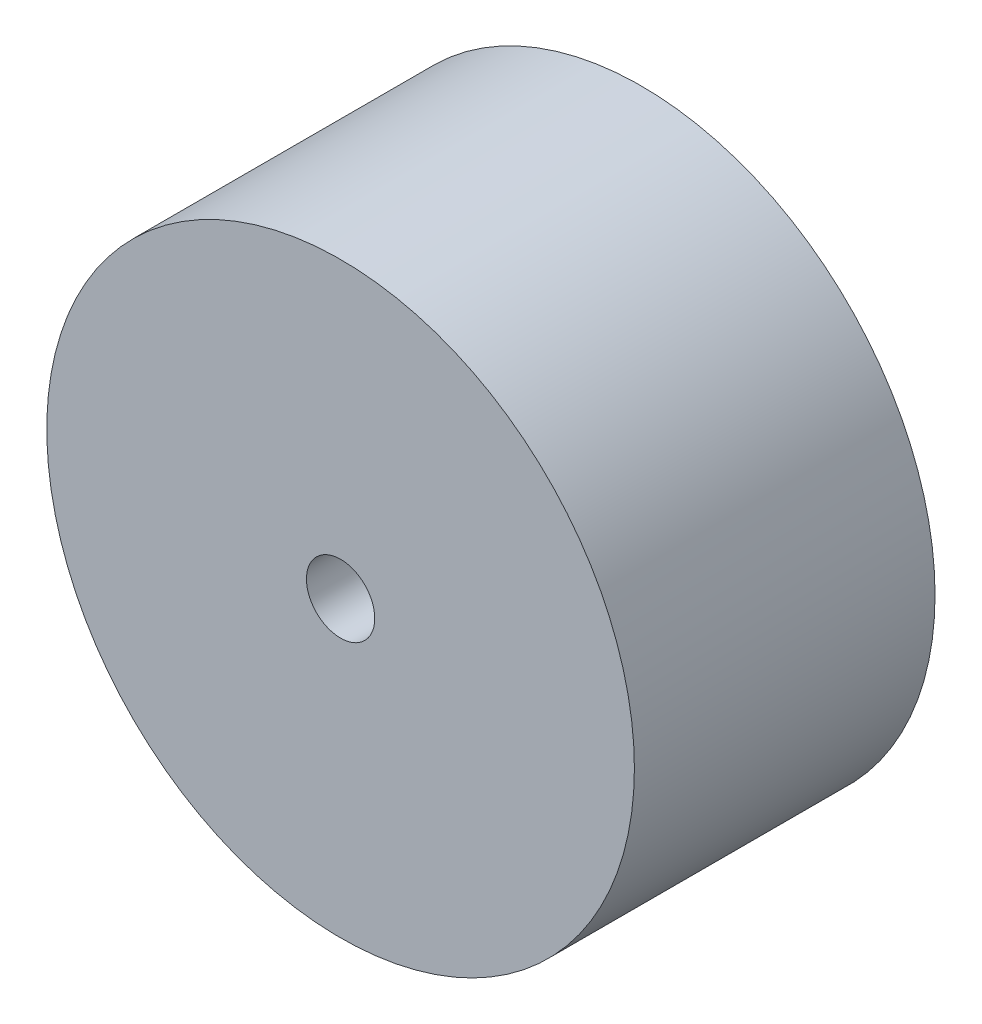
from build123d import *

# Parameters (mm, degrees)
SKETCH1_R           = 21.5
SKETCH1_R_2         = 2.5
BOSS_EXTRUDE1_DEPTH = 22


with BuildPart() as part:
    # Sketch1 → Boss-Extrude1 (new body)
    with BuildSketch(Plane.XY):
        Circle(SKETCH1_R)
        Circle(SKETCH1_R_2, mode=Mode.SUBTRACT)
    extrude(amount=BOSS_EXTRUDE1_DEPTH)


solid = part.part
